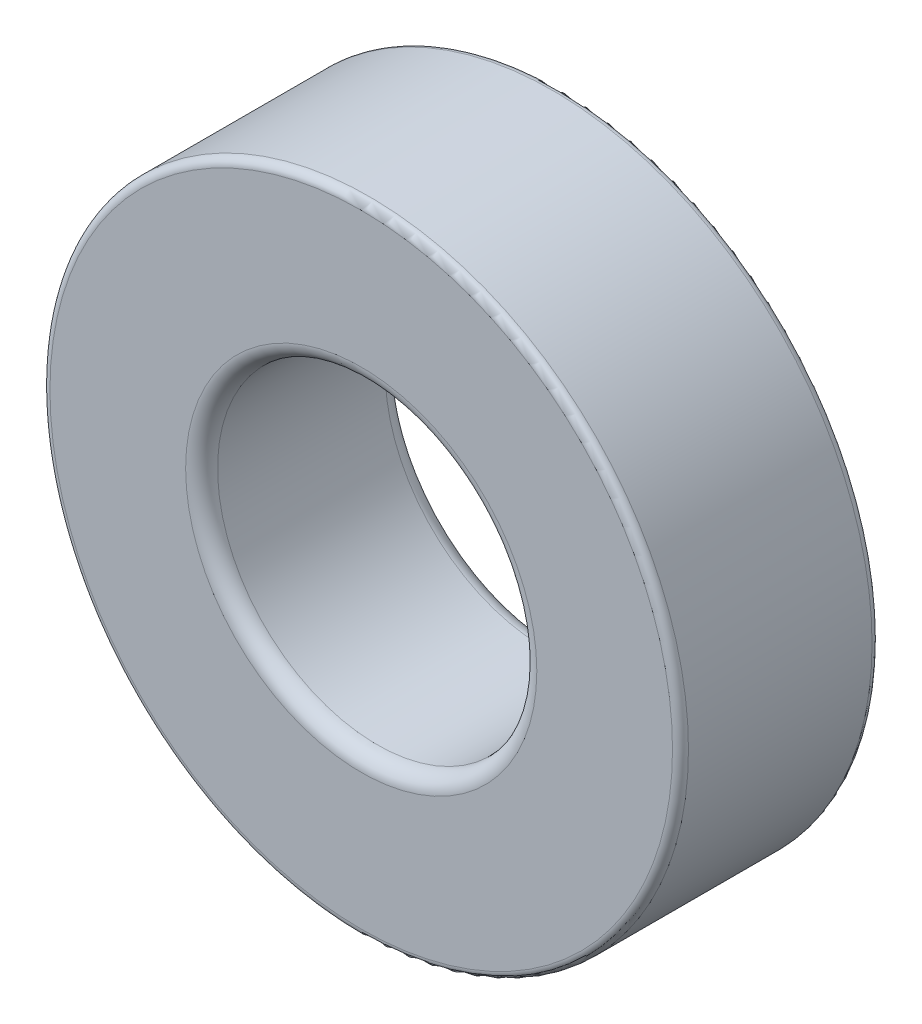
from build123d import *

# Parameters (mm, degrees)
BEARING_BOSS_EXTRUDE1_DEPTH      = 2.5
BEARING_BOSS_EXTRUDE1_DEPTH_BACK = 2.5
SKETCH1_R                        = 8
SKETCH1_R_2                      = 4
FILLET6_R                        = 0.2
FILLET7_R                        = 0.4


with BuildPart() as part:
    # Sketch1 → Bearing Boss-Extrude1 (new, two sides: drawn at the far end of the back side and taken through both)
    with BuildSketch(Plane.XY.offset(-BEARING_BOSS_EXTRUDE1_DEPTH_BACK)):
        Circle(SKETCH1_R)
        Circle(SKETCH1_R_2, mode=Mode.SUBTRACT)
    extrude(amount=BEARING_BOSS_EXTRUDE1_DEPTH + BEARING_BOSS_EXTRUDE1_DEPTH_BACK)

    # Fillet6
    fillet6_edges = [part.edges().sort_by_distance(p)[0] for p in [
        (-8, 0, 2.5),
        (-8, 0, -2.5),
    ]]
    fillet(fillet6_edges, radius=FILLET6_R)

    # Fillet7
    fillet7_edges = [part.edges().sort_by_distance(p)[0] for p in [
        (-4, 0, -2.5),
        (-4, 0, 2.5),
    ]]
    fillet(fillet7_edges, radius=FILLET7_R)


solid = part.part
